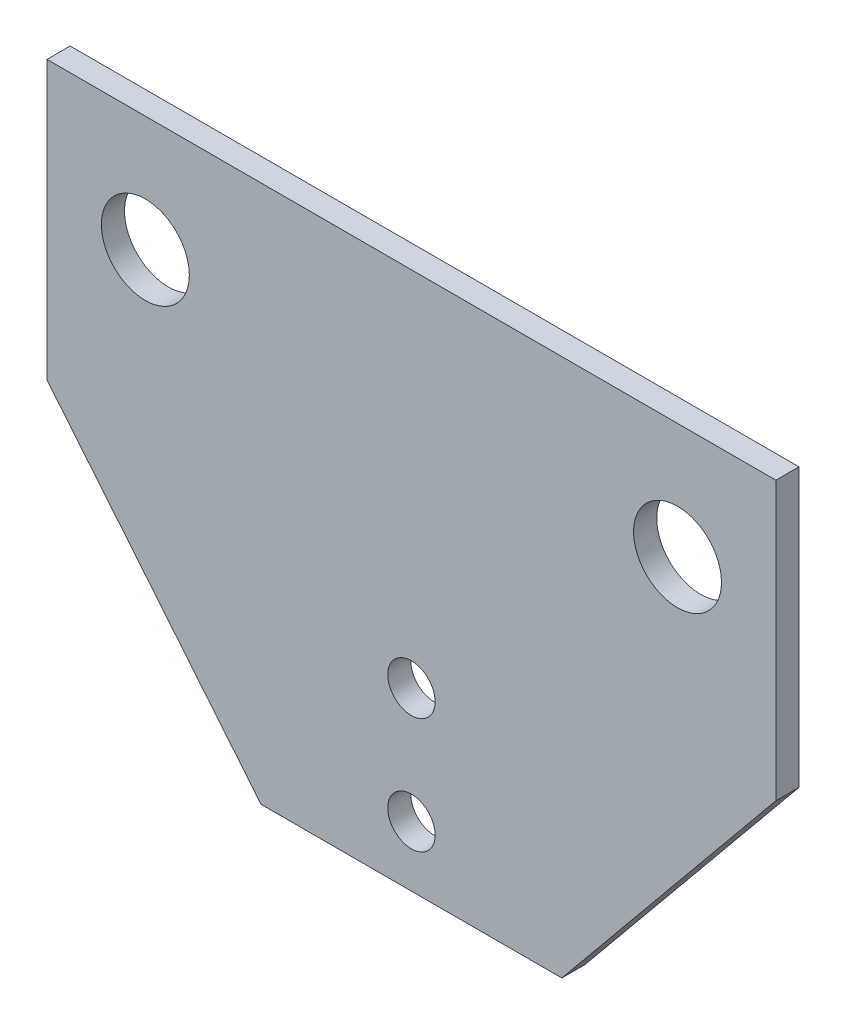
from build123d import *

# Parameters (mm, degrees)
SKETCH1_W           = 63
SKETCH1_H           = 24
SKETCH1_R           = 3.8
BOSS_EXTRUDE1_DEPTH = 2
SKETCH1_3_R         = 2.05
BOSS_EXTRUDE2_DEPTH = 2


with BuildPart() as part:
    # Sketch1 → Boss-Extrude1 (new body)
    with BuildSketch(Plane.XY):
        with Locations((0, -2)):
            Rectangle(SKETCH1_W, SKETCH1_H)
        with Locations((-23, 0)):
            Circle(SKETCH1_R, mode=Mode.SUBTRACT)
        with Locations((23, 0)):
            Circle(SKETCH1_R, mode=Mode.SUBTRACT)
    extrude(amount=BOSS_EXTRUDE1_DEPTH)

    # Sketch1<3> → Boss-Extrude2 (add)
    with BuildSketch(Plane.XY):
        Polygon((13, -36.51566868), (31.5, -14), (-31.5, -14), (-13, -36.51566868), (0, -36.51566868), align=None)
        with Locations((0, -31.299955557)):
            Circle(SKETCH1_3_R, mode=Mode.SUBTRACT)
        with Locations((0, -21.322069584)):
            Circle(SKETCH1_3_R, mode=Mode.SUBTRACT)
    extrude(amount=BOSS_EXTRUDE2_DEPTH)


solid = part.part
